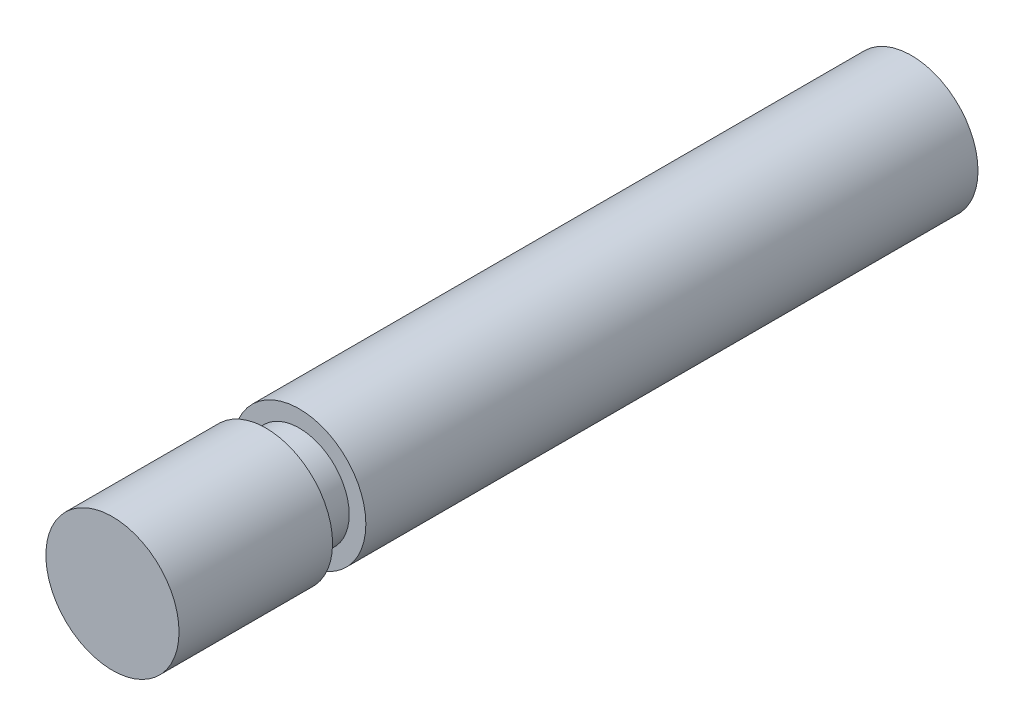
from build123d import *


with BuildPart() as part:
    # Sketch1 → Revolve1 (revolve)
    with BuildSketch(Plane(origin=(0, 0, 0), x_dir=(0, 0, -1), z_dir=(1, 0, 0)), mode=Mode.PRIVATE) as revolve1_sk:
        Polygon((0, 0), (0, 50), (115.3, 50), (115.3, 37.5), (140.3, 37.5), (140.3, 50), (209.4, 50), (234.4, 50), (542.731986085, 50), (600, 50), (600, 0), align=None)
    revolve(revolve1_sk.sketch.rotate(Axis((0, 0, 0), (0, 0, -1)), 90), axis=Axis((0, 0, 0), (0, 0, -1)))


solid = part.part
